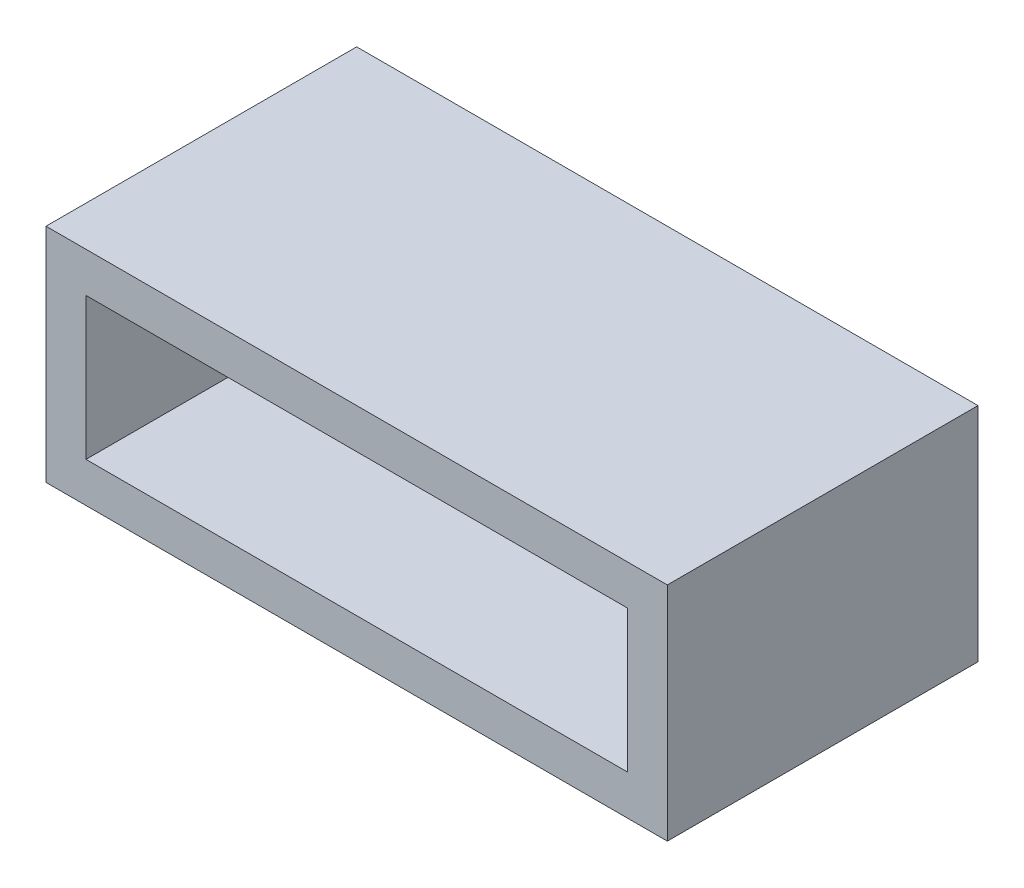
from build123d import *

# Parameters (mm, degrees)
SOFT_CONTACT_AND_WRAP_START     = -1
SOFT_CONTACT_AND_WRAP_PROFILE_W = 14
SOFT_CONTACT_AND_WRAP_PROFILE_H = 5
SOFT_CONTACT_AND_WRAP_DEPTH     = 7
FINGER_SLIP_POCKET_PROFILE_W    = 12.2
FINGER_SLIP_POCKET_PROFILE_H    = 3.2
OPEN_TOP_SLIP_POCKET_DEPTH      = 7
PAD_CAPTURE_M2_START            = -50
PAD_CAPTURE_M2_PROFILE_R        = 1.1
PAD_CAPTURE_M2_DEPTH            = 85.928498393


with BuildPart() as part:
    # Soft_contact_and_wrap_profile → Soft_contact_and_wrap (new body)
    with BuildSketch(Plane.XY.offset(SOFT_CONTACT_AND_WRAP_START)):
        with Locations((21, -17.5)):
            Rectangle(SOFT_CONTACT_AND_WRAP_PROFILE_W, SOFT_CONTACT_AND_WRAP_PROFILE_H)
    extrude(amount=SOFT_CONTACT_AND_WRAP_DEPTH)

    # Finger_slip_pocket_profile → Open_top_slip_pocket (cut)
    with BuildSketch(Plane.XY):
        with Locations((21, -17.5)):
            Rectangle(FINGER_SLIP_POCKET_PROFILE_W, FINGER_SLIP_POCKET_PROFILE_H)
    extrude(amount=OPEN_TOP_SLIP_POCKET_DEPTH, mode=Mode.SUBTRACT)

    # Pad_capture_M2_profile → Pad_capture_M2 (cut, through all)
    with BuildSketch(Plane.XY.offset(PAD_CAPTURE_M2_START)):
        with Locations(Location((18, -17.5, 0), (0, 0, 180))):
            Circle(PAD_CAPTURE_M2_PROFILE_R)
        with Locations(Location((24, -17.5, 0), (0, 0, 180))):
            Circle(PAD_CAPTURE_M2_PROFILE_R)
    extrude(amount=PAD_CAPTURE_M2_DEPTH, mode=Mode.SUBTRACT)


solid = part.part
